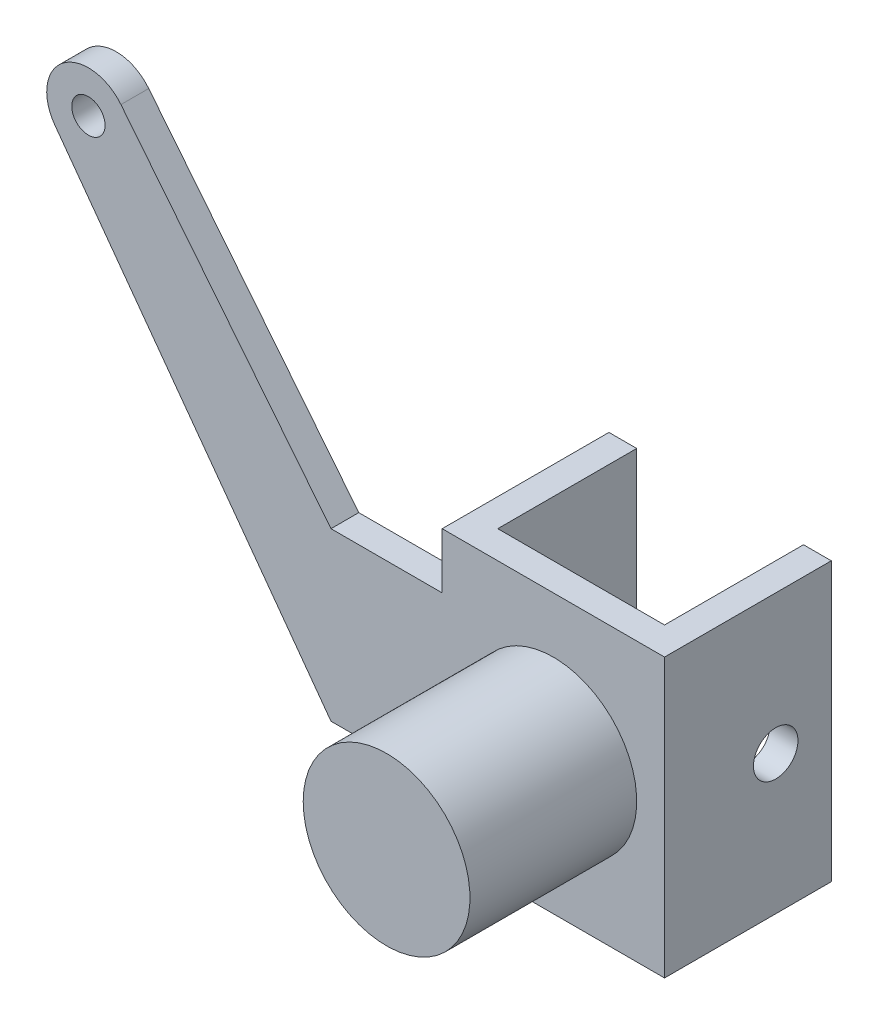
from build123d import *

# Parameters (mm, degrees)
SKETCH1_W           = 40
SKETCH1_H           = 50
BOSS_EXTRUDE1_DEPTH = 5
SKETCH2_W           = 5
SKETCH2_H           = 50
BOSS_EXTRUDE2_DEPTH = 25
SKETCH3_R           = 4
CUT_EXTRUDE1_DEPTH  = 56.901699437
SKETCH4_W           = 5
SKETCH4_H           = 30
BOSS_EXTRUDE3_DEPTH = 20
SKETCH5_R           = 3
BOSS_EXTRUDE4_DEPTH = 5
SKETCH6_R           = 15
BOSS_EXTRUDE5_DEPTH = 30


with BuildPart() as part:
    # Sketch1 → Boss-Extrude1 (new body)
    with BuildSketch(Plane.XY):
        Rectangle(SKETCH1_W, SKETCH1_H)
    extrude(amount=BOSS_EXTRUDE1_DEPTH)

    # Sketch2 → Boss-Extrude2 (add)
    with BuildSketch(Plane.XY.offset(5)):
        with Locations((-17.5, 0)):
            Rectangle(SKETCH2_W, SKETCH2_H)
        with Locations((17.5, 0)):
            Rectangle(SKETCH2_W, SKETCH2_H)
    extrude(amount=BOSS_EXTRUDE2_DEPTH)

    # Sketch3 → Cut-Extrude1 (cut, through all)
    with BuildSketch(Plane.ZY.offset(20)):
        with Locations((20, 0)):
            Circle(SKETCH3_R)
    extrude(amount=-CUT_EXTRUDE1_DEPTH, mode=Mode.SUBTRACT)

    # Sketch4 → Boss-Extrude3 (add)
    with BuildSketch(Plane.ZY.offset(20)):
        with Locations((2.5, 0)):
            Rectangle(SKETCH4_W, SKETCH4_H)
    extrude(amount=BOSS_EXTRUDE3_DEPTH)

    # Sketch5 → Boss-Extrude4 (add)
    with BuildSketch(Plane.XY.offset(5)):
        with BuildLine():
            Line((-40, 15), (-77.785894763, 62.179423312))
            ThreePointArc((-77.785894763, 62.179423312), (-88.196441443, 63.448140197), (-89.697194155, 53.068503112))
            Line((-89.697194155, 53.068503112), (-40, -15))
            Line((-40, -15), (-40, 15))
        make_face()
        with Locations((-83.639846307, 57.491006594)):
            Circle(SKETCH5_R, mode=Mode.SUBTRACT)
    extrude(amount=-BOSS_EXTRUDE4_DEPTH)

    # Sketch6 → Boss-Extrude5 (add)
    with BuildSketch(Plane(origin=(0, 0, 0), x_dir=(-1, 0, 0), z_dir=(0, 0, -1))):
        Circle(SKETCH6_R)
    extrude(amount=BOSS_EXTRUDE5_DEPTH)


with BuildPart() as body_2:
    # Mirror1: mirrored copy
    add(part.part.mirror(Plane(origin=(0, 0, -30), x_dir=(1, 0, 0), z_dir=(0, 0, -1))))


solid = body_2.part
